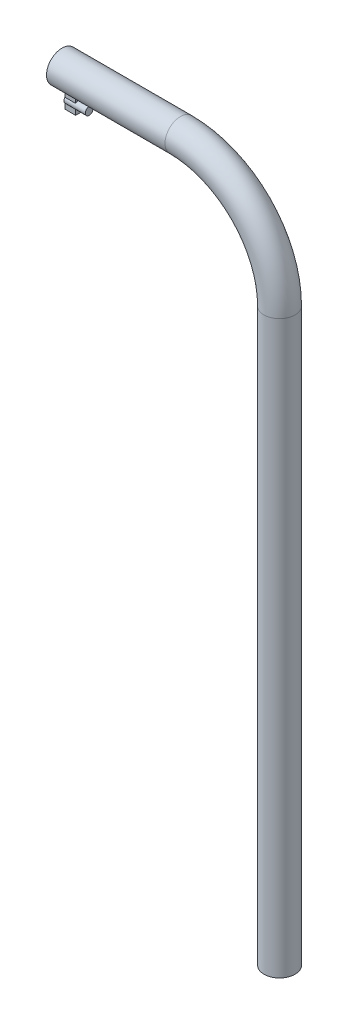
from build123d import *

# Parameters (mm, degrees)
BOSS_EXTRUDE1_START = -169
SKETCH1_R           = 8
BOSS_EXTRUDE1_DEPTH = 294
SKETCH3_R           = 8
BOSS_EXTRUDE2_START = 159
SKETCH4_W           = 5.5
SKETCH4_H           = 3
BOSS_EXTRUDE2_DEPTH = 13
SKETCH5_W           = 11
SKETCH5_H           = 2


with BuildPart() as part:
    # Sketch1 → Boss-Extrude1 (new body)
    with BuildSketch(Plane(origin=(0, 0, 0), x_dir=(1, 0, 0), z_dir=(0, 1, 0)).offset(BOSS_EXTRUDE1_START)):
        with Locations(Location((0, 0, 0), (0, 0, 270))):
            Circle(SKETCH1_R)
    extrude(amount=BOSS_EXTRUDE1_DEPTH)

    # Sweep1: sweep along a path in Sketch2
    with BuildLine(Plane.XY) as sweep1_path:
        Line((-112, 176), (-51, 176))
        ThreePointArc((-51, 176), (-14.937554159, 161.062445841), (0, 125))
    # Sketch3 → Sweep1 (sweep)
    with BuildSketch(Plane(origin=(0, 125, 0), x_dir=(1, 0, 0), z_dir=(0, 1, 0))):
        Circle(SKETCH3_R)
    sweep(path=sweep1_path.line)

    # Sketch4 → Boss-Extrude2 (add)
    with BuildSketch(Plane(origin=(0, 0, 0), x_dir=(1, 0, 0), z_dir=(0, 1, 0)).offset(BOSS_EXTRUDE2_START)):
        with Locations((-106.25, 0)):
            Rectangle(SKETCH4_W, SKETCH4_H)
    extrude(amount=BOSS_EXTRUDE2_DEPTH)

    # Sketch5 → Revolve1 (revolve)
    with BuildSketch(Plane.XY, mode=Mode.PRIVATE) as revolve1_sk:
        with Locations((-103.5, 164)):
            Rectangle(SKETCH5_W, SKETCH5_H)
    revolve(revolve1_sk.sketch.rotate(Axis((-109, 163, 0), (1, 0, 0)), 90), axis=Axis((-109, 163, 0), (1, 0, 0)))


solid = part.part
